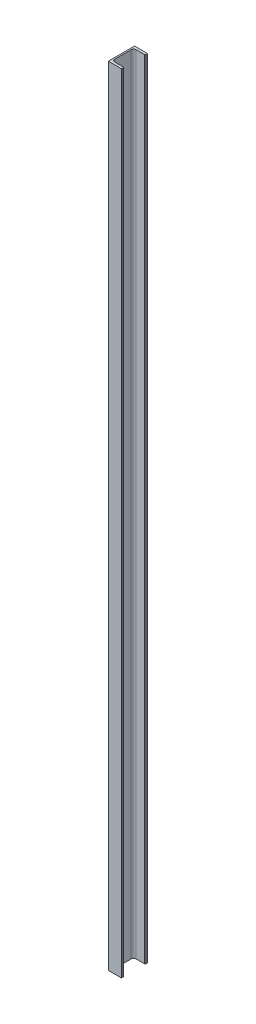
from build123d import *

# Parameters (mm, degrees)
EXTRUDE_1_DEPTH = 2400


with BuildPart() as part:
    # Эскиз1 → Бобышка-Вытянуть1 (new body)
    with BuildSketch(Plane(origin=(0, 0, 0), x_dir=(1, 0, 0), z_dir=(0, 1, 0))):
        with BuildLine():
            Line((20, 35.1), (20, 40))
            Line((20, 40), (-20, 40))
            Line((-20, 40), (-20, -40))
            Line((-20, -40), (20, -40))
            Line((20, -40), (20, -35.1))
            ThreePointArc((20, -35.1), (19.267766953, -33.332233047), (17.5, -32.6))
            Line((17.5, -32.6), (-8, -32.6))
            ThreePointArc((-8, -32.6), (-13.303300859, -30.403300859), (-15.5, -25.1))
            Line((-15.5, -25.1), (-15.5, 25.1))
            ThreePointArc((-15.5, 25.1), (-13.303300859, 30.403300859), (-8, 32.6))
            Line((-8, 32.6), (17.5, 32.6))
            ThreePointArc((17.5, 32.6), (19.267766953, 33.332233047), (20, 35.1))
        make_face()
    extrude(amount=EXTRUDE_1_DEPTH)


solid = part.part
